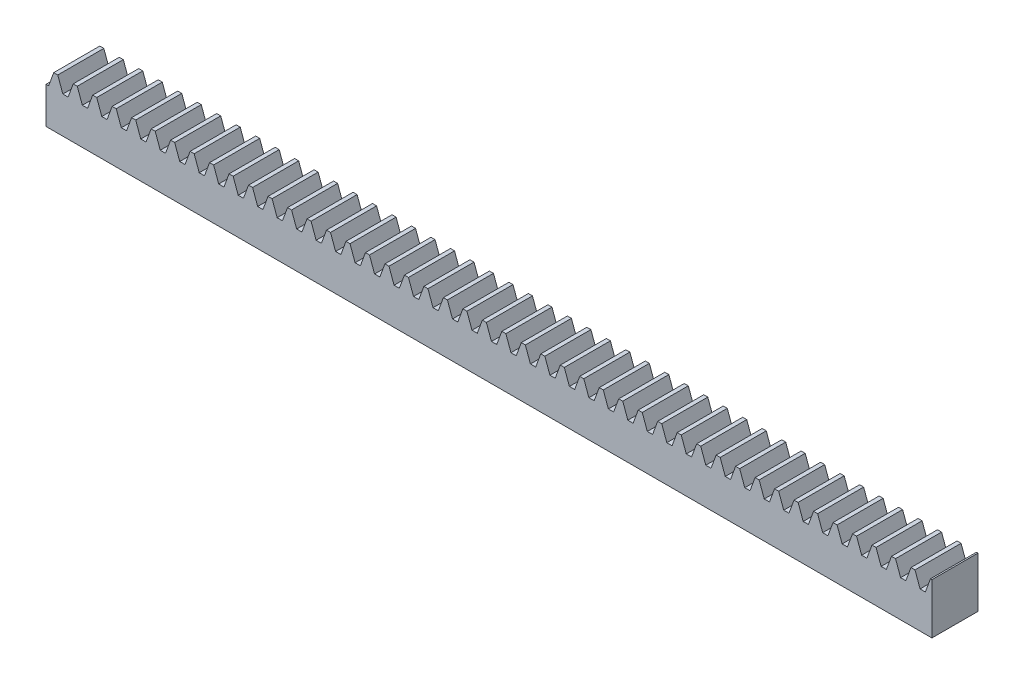
from build123d import *

# Parameters (mm, degrees)
BLANKSKE_W         = 10000
BLANKSKE_H         = 570
BLANK_DEPTH        = 520
TOOTHCUTSIM_DEPTH  = 10030.720833602
TEETHCUTS_COUNT    = 46
TEETHCUTS_PITCH    = 219.9114855
SKETCH1_R          = 127
CUT_EXTRUDE1_DEPTH = 127


with BuildPart() as part:
    # BlankSke → Blank (new body)
    with BuildSketch(Plane.XY):
        with Locations((5000, 285)):
            Rectangle(BLANKSKE_W, BLANKSKE_H)
    extrude(amount=-BLANK_DEPTH)

    # TooCutSkeSim → ToothCutSim (cut, through all)
    with BuildSketch(Plane.XY):
        Polygon((29.730475877, 412.5), (-29.730475877, 412.5), (-87.065032618, 570.0254), (87.065032618, 570.0254), align=None)
    toothcutsim = extrude(amount=-TOOTHCUTSIM_DEPTH, mode=Mode.SUBTRACT)

    # TeethCuts: ToothCutSim ×46
    with Locations(*[(i * TEETHCUTS_PITCH, 0, 0) for i in range(1, TEETHCUTS_COUNT)]):
        add(toothcutsim, mode=Mode.SUBTRACT)

    # Sketch1 → Cut-Extrude1 (cut)
    with BuildSketch(Plane.ZY):
        with Locations((-260, 206.25)):
            Circle(SKETCH1_R)
    extrude(amount=-CUT_EXTRUDE1_DEPTH, mode=Mode.SUBTRACT)


solid = part.part
